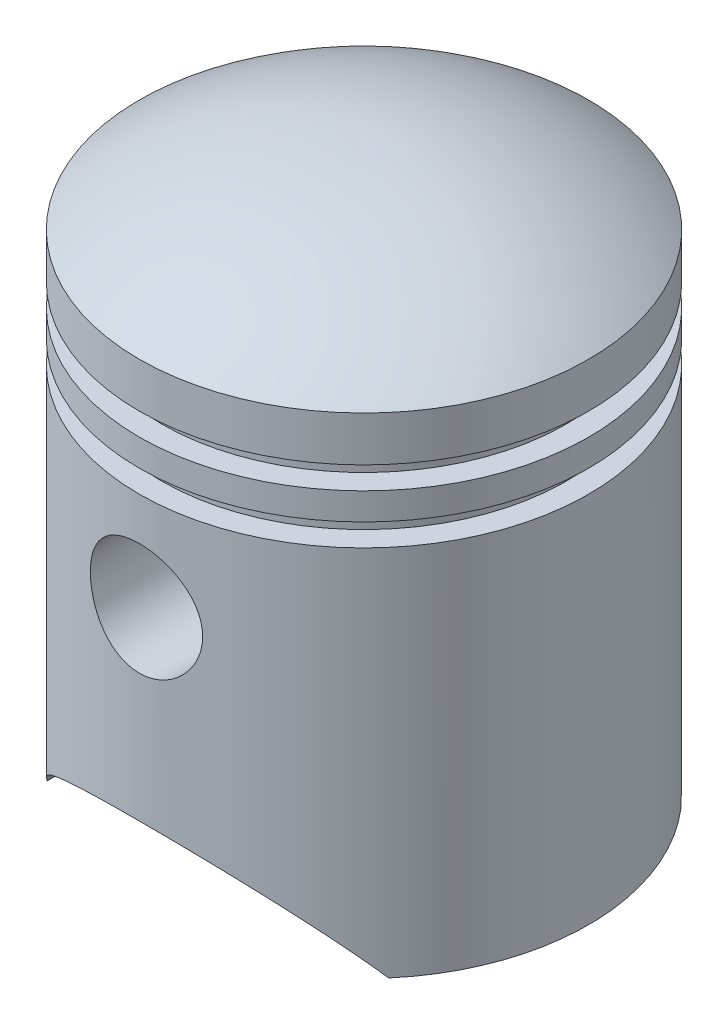
from build123d import *

# Parameters (mm, degrees)
CUT_EXTRUDE1_DEPTH       = 72.817566835
CUT_EXTRUDE1_DEPTH_BACK  = 72.817566835
SKETCH2_R                = 6.25
BOSS_EXTRUDE1_REACH      = 85.818
BOSS_EXTRUDE1_END_RADIUS = 23
BOSS_EXTRUDE1_START      = 12
SKETCH3_R                = 7.25
SKETCH3_R_2              = 6.25


with BuildPart() as part:
    # Sketch1 → Revolve1 (revolve)
    with BuildSketch(Plane.XY, mode=Mode.PRIVATE) as revolve1_sk:
        with BuildLine():
            Line((25, 0), (25, 41.5))
            Line((25, 41.5), (22.5, 41.5))
            Line((22.5, 41.5), (22.5, 44))
            Line((22.5, 44), (25, 44))
            Line((25, 44), (25, 47))
            Line((25, 47), (22.5, 47))
            Line((22.5, 47), (22.5, 49.5))
            Line((22.5, 49.5), (25, 49.5))
            Line((25, 49.5), (25, 54.5))
            ThreePointArc((25, 54.5), (13.174901691, 60.609067785), (0, 62.5))
            Line((0, 62.5), (0, 60.49936285))
            ThreePointArc((0, 60.49936285), (12.069492637, 58.859165445), (23, 53.484511145))
            Line((23, 53.484511145), (23, 51.5))
            Line((23, 51.5), (20.5, 51.5))
            Line((20.5, 51.5), (20.5, 45.5))
            Line((20.5, 45.5), (20.5, 39.5))
            Line((20.5, 39.5), (23, 39.5))
            Line((23, 39.5), (23, 0))
            Line((23, 0), (25, 0))
        make_face()
    revolve(revolve1_sk.sketch.rotate(Axis((0, 62.5, 0), (0, -1, 0)), 90), axis=Axis((0, 62.5, 0), (0, -1, 0)))

    # Sketch2 → Cut-Extrude1 (cut, two sides: drawn at the far end of the back side and taken through both)
    with BuildSketch(Plane.XY.offset(-CUT_EXTRUDE1_DEPTH_BACK)):
        with Locations((0, 30.5)):
            Circle(SKETCH2_R)
        with BuildLine():
            Line((-19, 0), (19, 0))
            ThreePointArc((19, 0), (0, 10), (-19, 0))
        make_face()
    extrude(amount=CUT_EXTRUDE1_DEPTH + CUT_EXTRUDE1_DEPTH_BACK, mode=Mode.SUBTRACT)

    # Boss-Extrude1: up to this cylinder (the profile starts inside it)
    boss_extrude1_end = Plane(origin=(0, 23.455061, 0), z_dir=(0, 1, 0)) * Cylinder(BOSS_EXTRUDE1_END_RADIUS, 218.636, mode=Mode.PRIVATE)
    # Sketch3 → Boss-Extrude1 (add, up to the surface)
    with BuildSketch(Plane.XY.offset(BOSS_EXTRUDE1_START), mode=Mode.PRIVATE) as boss_extrude1_sk1:
        with Locations(Location((0, 30.5, 0), (0, 0, 90))):
            Circle(SKETCH3_R)
        with Locations((0, 30.5)):
            Circle(SKETCH3_R_2, mode=Mode.SUBTRACT)
    boss_extrude1_tool1 = extrude(boss_extrude1_sk1.sketch, amount=BOSS_EXTRUDE1_REACH, mode=Mode.PRIVATE) & boss_extrude1_end
    boss_extrude1 = boss_extrude1_tool1.solids().sort_by_distance((0, 23.455061, 12))[0]
    add(boss_extrude1)

    # Mirror1: Boss-Extrude1 across plane
    add(boss_extrude1.mirror(Plane.XY))


solid = part.part
